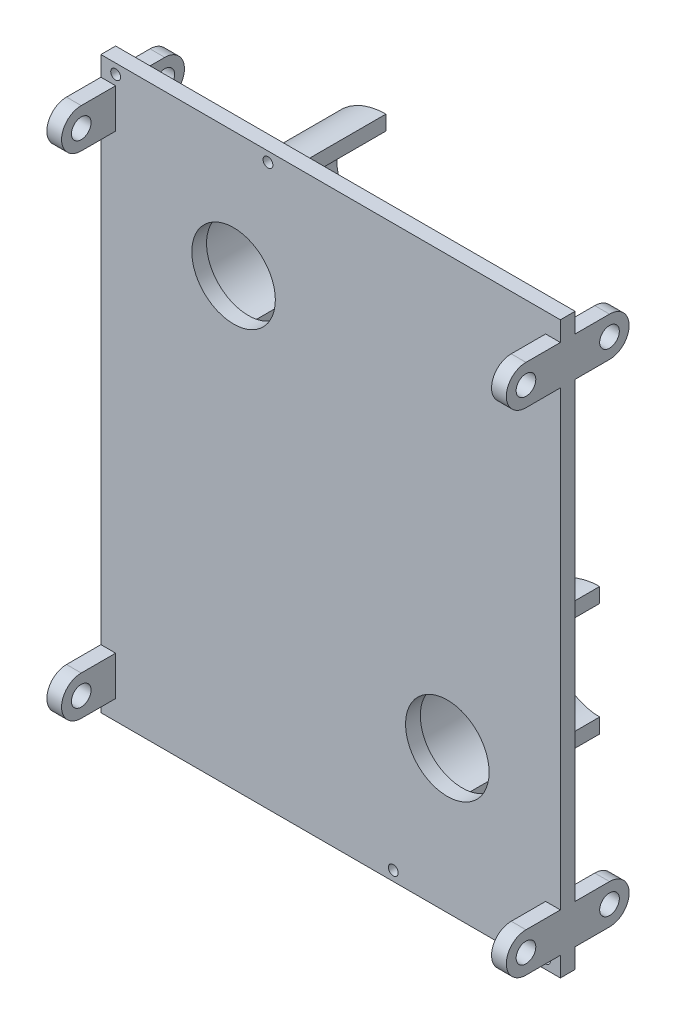
from build123d import *

# Parameters (mm, degrees)
SKETCH1_W           = 93.5
SKETCH1_H           = 116
BOSS_EXTRUDE1_DEPTH = 3
SKETCH2_R           = 8.5
CUT_EXTRUDE1_DEPTH  = 75.555767718
SKETCH4_R           = 2
BOSS_EXTRUDE3_DEPTH = 3
SKETCH6_R           = 1
CUT_EXTRUDE2_DEPTH  = 10
BOSS_EXTRUDE4_DEPTH = 28


with BuildPart() as part:
    # Sketch1 → Boss-Extrude1 (new body)
    with BuildSketch(Plane.XY):
        Rectangle(SKETCH1_W, SKETCH1_H)
    extrude(amount=BOSS_EXTRUDE1_DEPTH)

    # Sketch2 → Cut-Extrude1 (cut, through all)
    with BuildSketch(Plane.XY.offset(3)):
        with Locations((-19.75, 32.5)):
            Circle(SKETCH2_R)
        with Locations((23.75, -29)):
            Circle(SKETCH2_R)
    extrude(amount=-CUT_EXTRUDE1_DEPTH, mode=Mode.SUBTRACT)

    # Sketch4 → Boss-Extrude3 (add)
    # profile 1 of 4: a face of its own
    with BuildSketch(Plane.ZY.offset(46.75)):
        with BuildLine():
            Line((-7, 54), (0, 54))
            Line((0, 54), (0, 46))
            Line((0, 46), (-7, 46))
            ThreePointArc((-7, 46), (-11, 50), (-7, 54))
        make_face()
        with Locations((-7, 50)):
            Circle(SKETCH4_R, mode=Mode.SUBTRACT)
    # profile 2 of 4: a face of its own
    with BuildSketch(Plane.ZY.offset(46.75)):
        with BuildLine():
            Line((0, -46), (-7, -46))
            ThreePointArc((-7, -46), (-11, -50), (-7, -54))
            Line((-7, -54), (0, -54))
            Line((0, -54), (0, -46))
        make_face()
        with Locations((-7, -50)):
            Circle(SKETCH4_R, mode=Mode.SUBTRACT)
    # profile 3 of 4: a face of its own
    with BuildSketch(Plane.ZY.offset(46.75)):
        with BuildLine():
            Line((3, 46), (10, 46))
            ThreePointArc((10, 46), (14, 50), (10, 54))
            Line((10, 54), (3, 54))
            Line((3, 54), (3, 46))
        make_face()
        with Locations((10, 50)):
            Circle(SKETCH4_R, mode=Mode.SUBTRACT)
    # profile 4 of 4: a face of its own
    with BuildSketch(Plane.ZY.offset(46.75)):
        with BuildLine():
            Line((10, -54), (3, -54))
            Line((3, -54), (3, -46))
            Line((3, -46), (10, -46))
            ThreePointArc((10, -46), (14, -50), (10, -54))
        make_face()
        with Locations((10, -50)):
            Circle(SKETCH4_R, mode=Mode.SUBTRACT)
    boss_extrude3 = extrude(amount=-BOSS_EXTRUDE3_DEPTH)

    # Sketch6 → Cut-Extrude2 (cut)
    with BuildSketch(Plane.XY.offset(3)):
        with Locations((-43.75, 56)):
            Circle(SKETCH6_R)
        with Locations((-12.75, 56)):
            Circle(SKETCH6_R)
        with Locations((43.75, -56)):
            Circle(SKETCH6_R)
        with Locations((12.75, -56)):
            Circle(SKETCH6_R)
    extrude(amount=-CUT_EXTRUDE2_DEPTH, mode=Mode.SUBTRACT)

    # Sketch5 → Boss-Extrude4 (add)
    with BuildSketch(Plane(origin=(0, 0, 0), x_dir=(-1, 0, 0), z_dir=(0, 0, -1))):
        with BuildLine():
            Line((19.75, 45.5), (19.75, 42.5))
            ThreePointArc((19.75, 42.5), (29.75, 32.5), (19.75, 22.5))
            Line((19.75, 22.5), (19.75, 19.5))
            ThreePointArc((19.75, 19.5), (32.75, 32.5), (19.75, 45.5))
        make_face()
        with BuildLine():
            Line((-23.75, -16), (-23.75, -19))
            ThreePointArc((-23.75, -19), (-13.75, -29), (-23.75, -39))
            Line((-23.75, -39), (-23.75, -42))
            ThreePointArc((-23.75, -42), (-10.75, -29), (-23.75, -16))
        make_face()
    extrude(amount=BOSS_EXTRUDE4_DEPTH)

    # Mirror1: Boss-Extrude3 across plane
    add(boss_extrude3.mirror(Plane(origin=(0, 0, 0), x_dir=(0, 0, 1), z_dir=(1, 0, 0))))


solid = part.part
